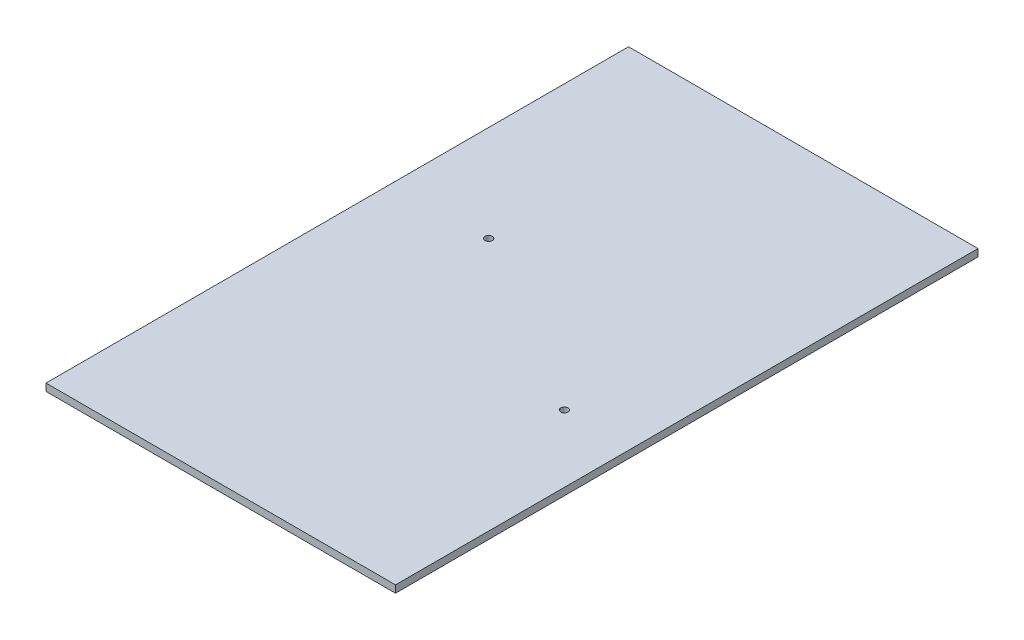
from build123d import *

# Parameters (mm, degrees)
SKETCH1_W           = 152.4
SKETCH1_H           = 254
BOSS_EXTRUDE1_DEPTH = 3.175
SKETCH4_R           = 1.5875
CUT_EXTRUDE1_DEPTH  = 149.140205971


with BuildPart() as part:
    # Sketch1 → Boss-Extrude1 (new body)
    with BuildSketch(Plane(origin=(0, 0, 0), x_dir=(1, 0, 0), z_dir=(0, 1, 0))):
        Rectangle(SKETCH1_W, SKETCH1_H)
    extrude(amount=BOSS_EXTRUDE1_DEPTH)

    # Sketch4 → Cut-Extrude1 (cut, through all)
    with BuildSketch(Plane(origin=(0, 3.175, 0), x_dir=(1, 0, 0), z_dir=(0, 1, 0))):
        with Locations(Location((-34.29, 24.13, 0), (0, 0, 270))):
            Circle(SKETCH4_R)
        with Locations(Location((46.99, -24.13, 0), (0, 0, 270))):
            Circle(SKETCH4_R)
    extrude(amount=-CUT_EXTRUDE1_DEPTH, mode=Mode.SUBTRACT)


solid = part.part
